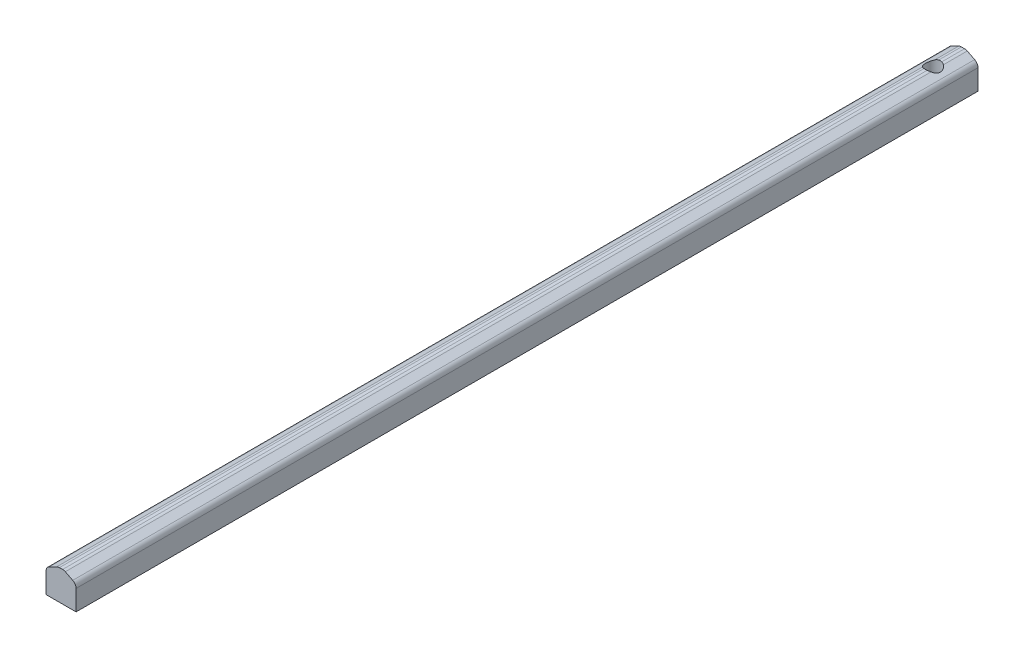
from build123d import *

# Parameters (mm, degrees)
ESQUISSE1_W             = 10
ESQUISSE1_H             = 10
BOSS_EXTRU_1_DEPTH      = 300
ESQUISSE2_R             = 2.5
ENL_V_MAT_EXTRU_1_DEPTH = 301.333148354
ENL_V_MAT_EXTRU_2_DEPTH = 301.333148354
CONG_2_R                = 2
CONG_3_R                = 2
CONG_4_R                = 2


with BuildPart() as part:
    # Esquisse1 → Boss.-Extru.1 (new body)
    with BuildSketch(Plane.XY):
        with Locations((5, 5)):
            Rectangle(ESQUISSE1_W, ESQUISSE1_H)
    extrude(amount=BOSS_EXTRU_1_DEPTH)

    # Esquisse2 → Enlèv. mat.-Extru.1 (cut, through all)
    with BuildSketch(Plane(origin=(0, 10, 0), x_dir=(1, 0, 0), z_dir=(0, 1, 0))):
        with Locations(Location((5, -10, 0), (0, 0, 270))):
            Circle(ESQUISSE2_R)
    extrude(amount=-ENL_V_MAT_EXTRU_1_DEPTH, mode=Mode.SUBTRACT)

    # Esquisse3 → Enlèv. mat.-Extru.2 (cut, through all)
    with BuildSketch(Plane(origin=(0, 0, 0), x_dir=(-1, 0, 0), z_dir=(0, 0, -1))):
        Polygon((0, 10), (0, 8), (-4, 10), align=None)
        Polygon((-10, 10), (-10, 8), (-6, 10), align=None)
    extrude(amount=-ENL_V_MAT_EXTRU_2_DEPTH, mode=Mode.SUBTRACT)

    # Congé2
    cong_2_edges = [part.edges().sort_by_distance(p)[0] for p in [
        (6, 10, 156.145643924),
        (4, 10, 156.145643924),
    ]]
    fillet(cong_2_edges, radius=CONG_2_R)

    # Congé3
    cong_3_edges = [part.edges().sort_by_distance(p)[0] for p in [
        (0, 8, 150),
        (10, 8, 150),
    ]]
    fillet(cong_3_edges, radius=CONG_3_R)

    # Congé4
    cong_4_edges = [part.edges().sort_by_distance(p)[0] for p in [
        (6, 10, 3.854356076),
        (4, 10, 3.854356076),
    ]]
    fillet(cong_4_edges, radius=CONG_4_R)


solid = part.part
